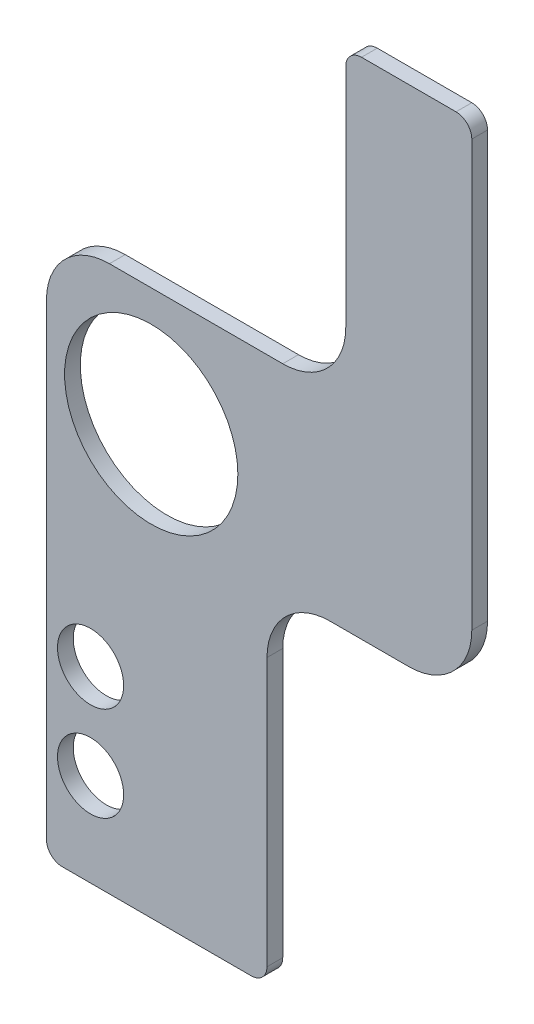
from build123d import *

# Parameters (mm, degrees)
SKETCH2_R           = 2.1
SKETCH2_R_2         = 5.5
BOSS_EXTRUDE1_DEPTH = 1


with BuildPart() as part:
    # Sketch2 → Boss-Extrude1 (new body)
    with BuildSketch(Plane.XY):
        with BuildLine():
            Line((4.823205975, -0.488496739), (9.823205975, -0.488496739))
            ThreePointArc((9.823205975, -0.488496739), (12.6516331, 0.683076137), (13.823205975, 3.511503261))
            Line((13.823205975, 3.511503261), (13.823205975, 30.511503261))
            ThreePointArc((13.823205975, 30.511503261), (13.530312756, 31.218610043), (12.823205975, 31.511503261))
            Line((12.823205975, 31.511503261), (6.823205975, 31.511503261))
            ThreePointArc((6.823205975, 31.511503261), (6.116099194, 31.218610043), (5.823205975, 30.511503261))
            Line((5.823205975, 30.511503261), (5.823205975, 16.161503261))
            ThreePointArc((5.823205975, 16.161503261), (4.6516331, 13.333076137), (1.823205975, 12.161503261))
            Line((1.823205975, 12.161503261), (-9.176794025, 12.161503261))
            ThreePointArc((-9.176794025, 12.161503261), (-12.00522115, 10.989930386), (-13.176794025, 8.161503261))
            Line((-13.176794025, 8.161503261), (-13.176794025, -21.488496739))
            ThreePointArc((-13.176794025, -21.488496739), (-12.883900806, -22.19560352), (-12.176794025, -22.488496739))
            Line((-12.176794025, -22.488496739), (-0.176794025, -22.488496739))
            ThreePointArc((-0.176794025, -22.488496739), (0.530312756, -22.19560352), (0.823205975, -21.488496739))
            Line((0.823205975, -21.488496739), (0.823205975, -4.488496739))
            ThreePointArc((0.823205975, -4.488496739), (1.99477885, -1.660069614), (4.823205975, -0.488496739))
        make_face()
        with Locations((-10.376794025, -16.588496739)):
            Circle(SKETCH2_R, mode=Mode.SUBTRACT)
        with Locations((-10.376794025, -10.588496739)):
            Circle(SKETCH2_R, mode=Mode.SUBTRACT)
        with Locations((-6.526794025, 4.661503261)):
            Circle(SKETCH2_R_2, mode=Mode.SUBTRACT)
    extrude(amount=BOSS_EXTRUDE1_DEPTH)


solid = part.part
